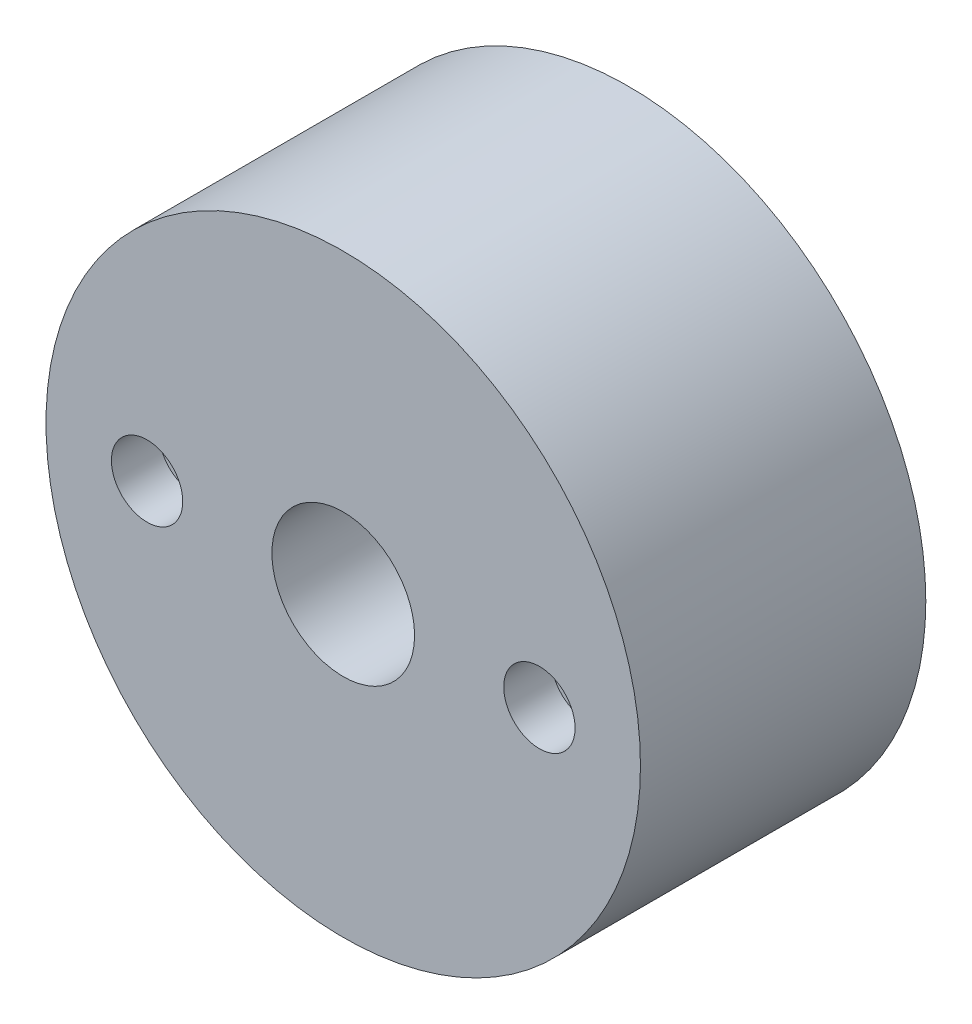
from build123d import *

# Parameters (mm, degrees)
ESQUISSE1_R             = 12.5
BOSS_EXTRU_1_DEPTH      = 12
ESQUISSE2_R             = 3
ENL_V_MAT_EXTRU_1_DEPTH = 12
ESQUISSE3_R             = 1.5
ENL_V_MAT_EXTRU_2_DEPTH = 2


with BuildPart() as part:
    # Esquisse1 → Boss.-Extru.1 (new body)
    with BuildSketch(Plane.XY):
        Circle(ESQUISSE1_R)
    extrude(amount=BOSS_EXTRU_1_DEPTH)

    # Esquisse2 → Enlèv. mat.-Extru.1 (cut)
    with BuildSketch(Plane.XY.offset(12)):
        Circle(ESQUISSE2_R)
    extrude(amount=-ENL_V_MAT_EXTRU_1_DEPTH, mode=Mode.SUBTRACT)

    # Esquisse3 → Enlèv. mat.-Extru.2 (cut)
    with BuildSketch(Plane.XY.offset(12)):
        with Locations((-8.25, 0)):
            Circle(ESQUISSE3_R)
        with Locations((8.25, 0)):
            Circle(ESQUISSE3_R)
    extrude(amount=-ENL_V_MAT_EXTRU_2_DEPTH, mode=Mode.SUBTRACT)


solid = part.part
